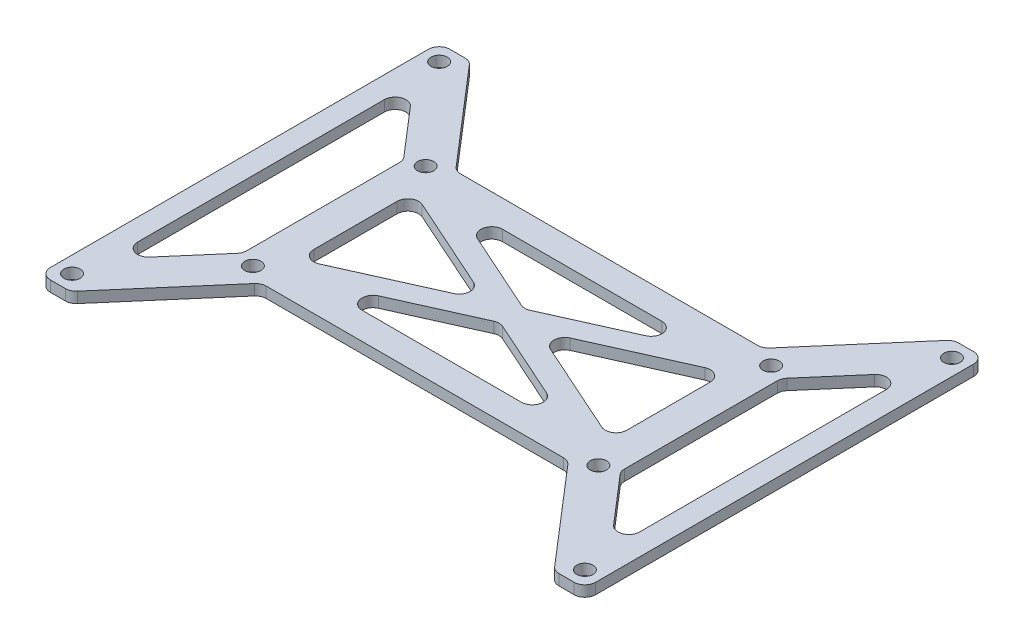
from build123d import *

# Parameters (mm, degrees)
SKETCH_1_W          = 101
SKETCH_1_H          = 74
SKETCH_1_R          = 1.5
EXTRUDE_1_DEPTH     = 2
SKETCH_2_W          = 58
SKETCH_2_H          = 26
CUT_EXTRUDE_1_DEPTH = 2
CUT_EXTRUDE_2_DEPTH = 2
EXTRUDE_2_DEPTH     = 2
CUT_EXTRUDE_3_DEPTH = 2
FILLET_1_R          = 2


with BuildPart() as part:
    # 草图1 → 凸台-拉伸1 (new body)
    with BuildSketch(Plane(origin=(0, 0, 0), x_dir=(1, 0, 0), z_dir=(0, 1, 0))):
        Rectangle(SKETCH_1_W, SKETCH_1_H)
        with Locations(Location((32, -16, 0), (0, 0, 270))):
            Circle(SKETCH_1_R, mode=Mode.SUBTRACT)
        with Locations(Location((32, 16, 0), (0, 0, 270))):
            Circle(SKETCH_1_R, mode=Mode.SUBTRACT)
        with Locations(Location((-32, 16, 0), (0, 0, 270))):
            Circle(SKETCH_1_R, mode=Mode.SUBTRACT)
        with Locations(Location((-32, -16, 0), (0, 0, 270))):
            Circle(SKETCH_1_R, mode=Mode.SUBTRACT)
        with Locations(Location((47.5, 34, 0), (0, 0, 270))):
            Circle(SKETCH_1_R, mode=Mode.SUBTRACT)
        with Locations(Location((-47.5, 34, 0), (0, 0, 270))):
            Circle(SKETCH_1_R, mode=Mode.SUBTRACT)
        with Locations(Location((-47.5, -34, 0), (0, 0, 270))):
            Circle(SKETCH_1_R, mode=Mode.SUBTRACT)
        with Locations(Location((47.5, -34, 0), (0, 0, 270))):
            Circle(SKETCH_1_R, mode=Mode.SUBTRACT)
    extrude(amount=EXTRUDE_1_DEPTH)

    # 草图2 → 切除-拉伸1 (cut)
    with BuildSketch(Plane(origin=(0, 2, 0), x_dir=(1, 0, 0), z_dir=(0, 1, 0))):
        Rectangle(SKETCH_2_W, SKETCH_2_H)
    extrude(amount=-CUT_EXTRUDE_1_DEPTH, mode=Mode.SUBTRACT)

    # 草图3 → 切除-拉伸2 (cut)
    with BuildSketch(Plane(origin=(0, 2, 0), x_dir=(1, 0, 0), z_dir=(0, 1, 0))):
        Polygon((-44.804678435, 37), (-28.443567324, 18), (28.443567324, 18), (44.804678435, 37), align=None)
    cut_extrude_2 = extrude(amount=-CUT_EXTRUDE_2_DEPTH, mode=Mode.SUBTRACT)

    # 镜向1: 切除-拉伸2 across plane
    add(cut_extrude_2.mirror(Plane.XY), mode=Mode.SUBTRACT)

    # 草图4 → 凸台-拉伸2 (add)
    with BuildSketch(Plane(origin=(0, 2, 0), x_dir=(1, 0, 0), z_dir=(0, 1, 0))):
        Polygon((0, -2.191758425), (-4.889307256, 0), (-29, -10.808241575), (-29, -13), (-24.110692744, -13), align=None)
        Polygon((-29, 13), (-29, 10.808241575), (-4.889307256, 0), (0, 2.191758425), (-24.110692744, 13), align=None)
        Polygon((0, 2.191758425), (-4.889307256, 0), (0, -2.191758425), (4.889307256, 0), align=None)
        Polygon((24.110692744, 13), (0, 2.191758425), (4.889307256, 0), (29, 10.808241575), (29, 13), align=None)
        Polygon((4.889307256, 0), (0, -2.191758425), (24.110692744, -13), (29, -13), (29, -10.808241575), align=None)
    extrude(amount=-EXTRUDE_2_DEPTH)

    # 草图5 → 切除-拉伸3 (cut)
    with BuildSketch(Plane.XZ):
        Polygon((-46.5, 28.241171541), (-35, 14.886332831), (-35, -14.886332831), (-46.5, -28.241171541), align=None)
    cut_extrude_3 = extrude(amount=-CUT_EXTRUDE_3_DEPTH, mode=Mode.SUBTRACT)

    # 镜向2: 切除-拉伸3 across plane
    add(cut_extrude_3.mirror(Plane(origin=(0, 0, 0), x_dir=(0, 0, 1), z_dir=(1, 0, 0))), mode=Mode.SUBTRACT)

    # 圆角1
    fillet_1_edges = [part.edges().sort_by_distance(p)[0] for p in [
        (0, 1, 2.191758425),
        (-24.110692744, 1, 13),
        (-29, 1, 10.808241575),
        (-4.889307256, 1, 0),
        (-29, 1, -10.808241575),
        (-24.110692744, 1, -13),
        (0, 1, -2.191758425),
        (24.110692744, 1, -13),
        (29, 1, -10.808241575),
        (4.889307256, 1, 0),
        (29, 1, 10.808241575),
        (24.110692744, 1, 13),
        (-46.5, 1, -28.241171541),
        (-46.5, 1, 28.241171541),
        (-35, 1, 14.886332831),
        (-35, 1, -14.886332831),
        (46.5, 1, 28.241171541),
        (46.5, 1, -28.241171541),
        (35, 1, -14.886332831),
        (35, 1, 14.886332831),
        (-44.804678435, 1, -37),
        (44.804678435, 1, -37),
        (28.443567324, 1, -18),
        (-28.443567324, 1, -18),
        (-50.5, 1, 37),
        (-50.5, 1, -37),
        (50.5, 1, -37),
        (50.5, 1, 37),
        (44.804678435, 1, 37),
        (-44.804678435, 1, 37),
        (-28.443567324, 1, 18),
        (28.443567324, 1, 18),
    ]]
    fillet(fillet_1_edges, radius=FILLET_1_R)


solid = part.part
